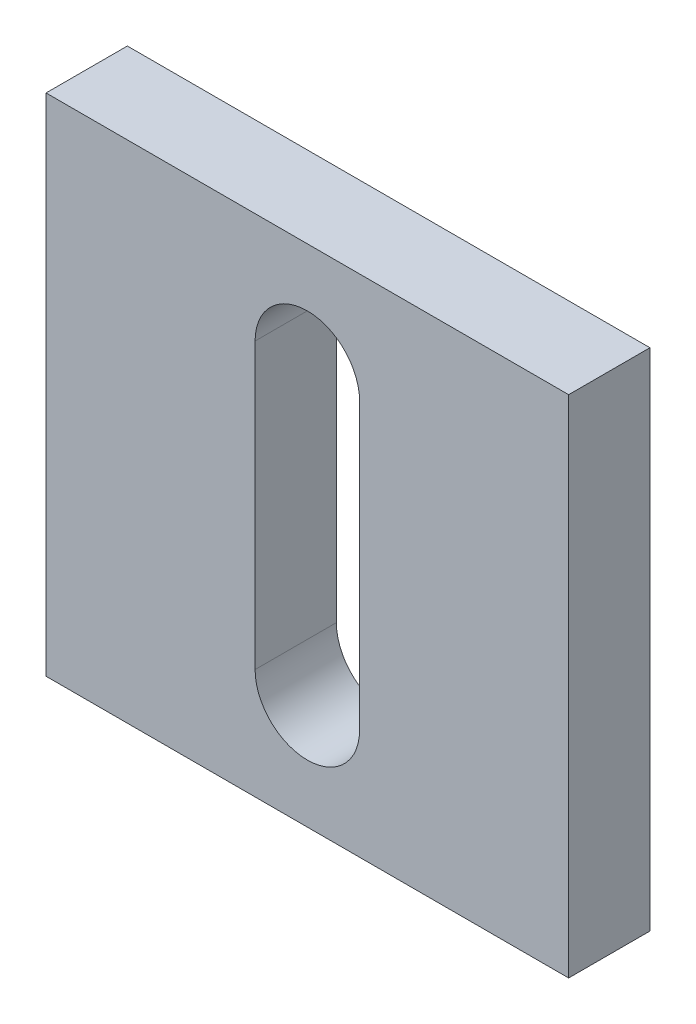
from build123d import *

# Parameters (mm, degrees)
SKETCH1_W           = 90
SKETCH1_H           = 87
BOSS_EXTRUDE1_DEPTH = 14
CUT_EXTRUDE1_DEPTH  = 63


with BuildPart() as part:
    # Sketch1 → Boss-Extrude1 (new body)
    with BuildSketch(Plane.XY):
        with Locations((45, 43.5)):
            Rectangle(SKETCH1_W, SKETCH1_H)
    extrude(amount=BOSS_EXTRUDE1_DEPTH)

    # Sketch2 → Cut-Extrude1 (cut)
    with BuildSketch(Plane.XY.offset(14)):
        with BuildLine():
            Line((54, 19), (54, 68))
            ThreePointArc((54, 68), (45, 77), (36, 68))
            Line((36, 68), (36, 19))
            ThreePointArc((36, 19), (45, 10), (54, 19))
        make_face()
    extrude(amount=-CUT_EXTRUDE1_DEPTH, mode=Mode.SUBTRACT)


solid = part.part
